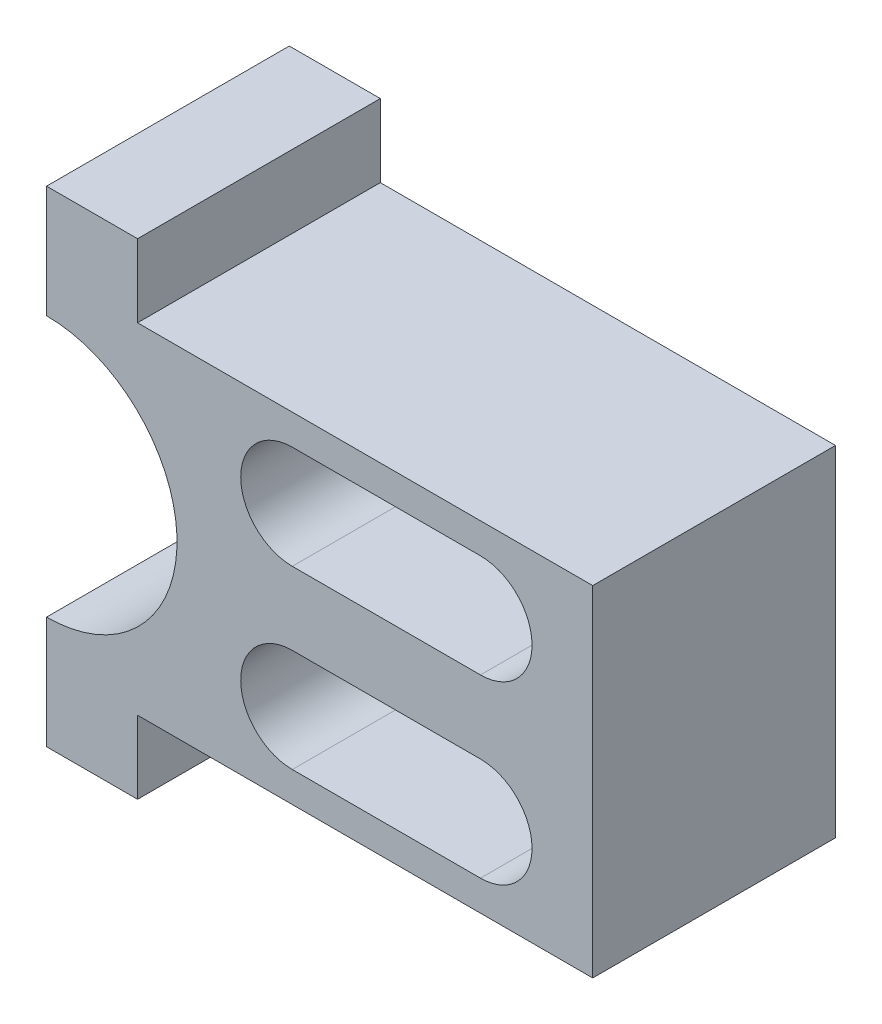
from build123d import *

# Parameters (mm, degrees)
EXTRUDE_1_DEPTH     = 40
SKETCH_2_W          = 75
SKETCH_2_H          = 12
CUT_EXTRUDE_1_DEPTH = 73.284161474


with BuildPart() as part:
    # Эскиз1 → Бобышка-Вытянуть1 (new body)
    with BuildSketch(Plane.XY):
        with BuildLine():
            Line((45, -40), (45, 40))
            Line((45, 40), (-45, 40))
            Line((-45, 40), (-45, 21.5))
            ThreePointArc((-45, 21.5), (-23.5, 0), (-45, -21.5))
            Line((-45, -21.5), (-45, -40))
            Line((-45, -40), (45, -40))
        make_face()
        with BuildLine():
            ThreePointArc((-4.5, -23), (-13, -14.5), (-4.5, -6))
            Line((-4.5, -6), (26.5, -6))
            ThreePointArc((26.5, -6), (35, -14.5), (26.5, -23))
            Line((26.5, -23), (-4.5, -23))
        make_face(mode=Mode.SUBTRACT)
        with BuildLine():
            Line((26.5, 6), (-4.5, 6))
            ThreePointArc((-4.5, 6), (-13, 14.5), (-4.5, 23))
            Line((-4.5, 23), (26.5, 23))
            ThreePointArc((26.5, 23), (35, 14.5), (26.5, 6))
        make_face(mode=Mode.SUBTRACT)
    extrude(amount=EXTRUDE_1_DEPTH)

    # Эскиз2 → Вырез-Вытянуть1 (cut, through all)
    with BuildSketch(Plane.XY.offset(40)):
        with Locations((7.5, 34)):
            Rectangle(SKETCH_2_W, SKETCH_2_H)
    cut_extrude_1 = extrude(amount=-CUT_EXTRUDE_1_DEPTH, mode=Mode.SUBTRACT)

    # Зеркальное отражение1: Вырез-Вытянуть1 across plane
    add(cut_extrude_1.mirror(Plane.ZX), mode=Mode.SUBTRACT)


solid = part.part
